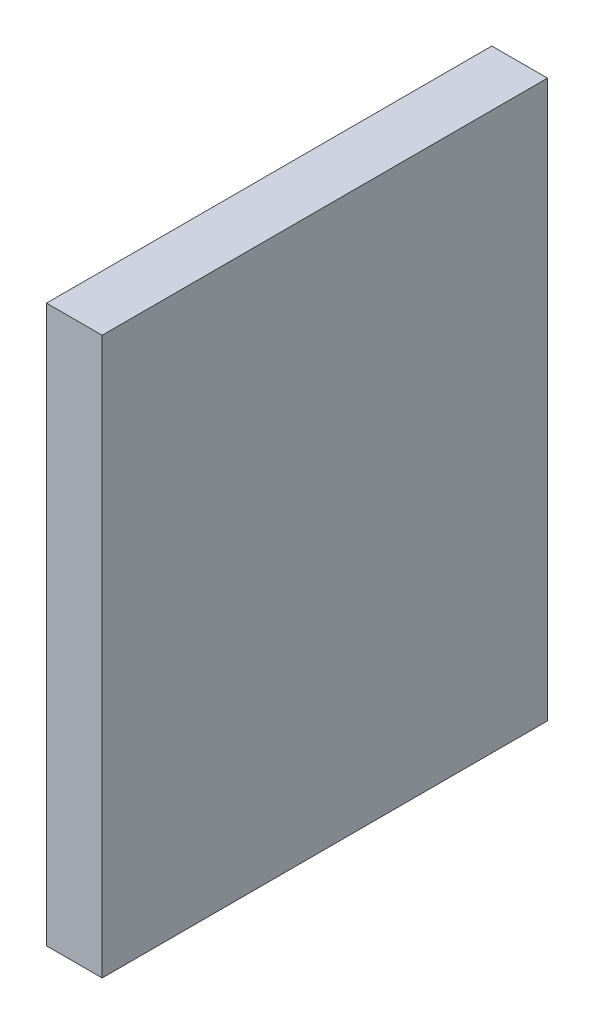
from build123d import *

# Parameters (mm, degrees)
SKETCH1_W           = 12.7
SKETCH1_H           = 101.6
BOSS_EXTRUDE1_DEPTH = 127


with BuildPart() as part:
    # Sketch1 → Boss-Extrude1 (new body)
    with BuildSketch(Plane(origin=(0, 0, 0), x_dir=(1, 0, 0), z_dir=(0, 1, 0))):
        with Locations((6.35, 50.8)):
            Rectangle(SKETCH1_W, SKETCH1_H)
    extrude(amount=BOSS_EXTRUDE1_DEPTH)


solid = part.part
